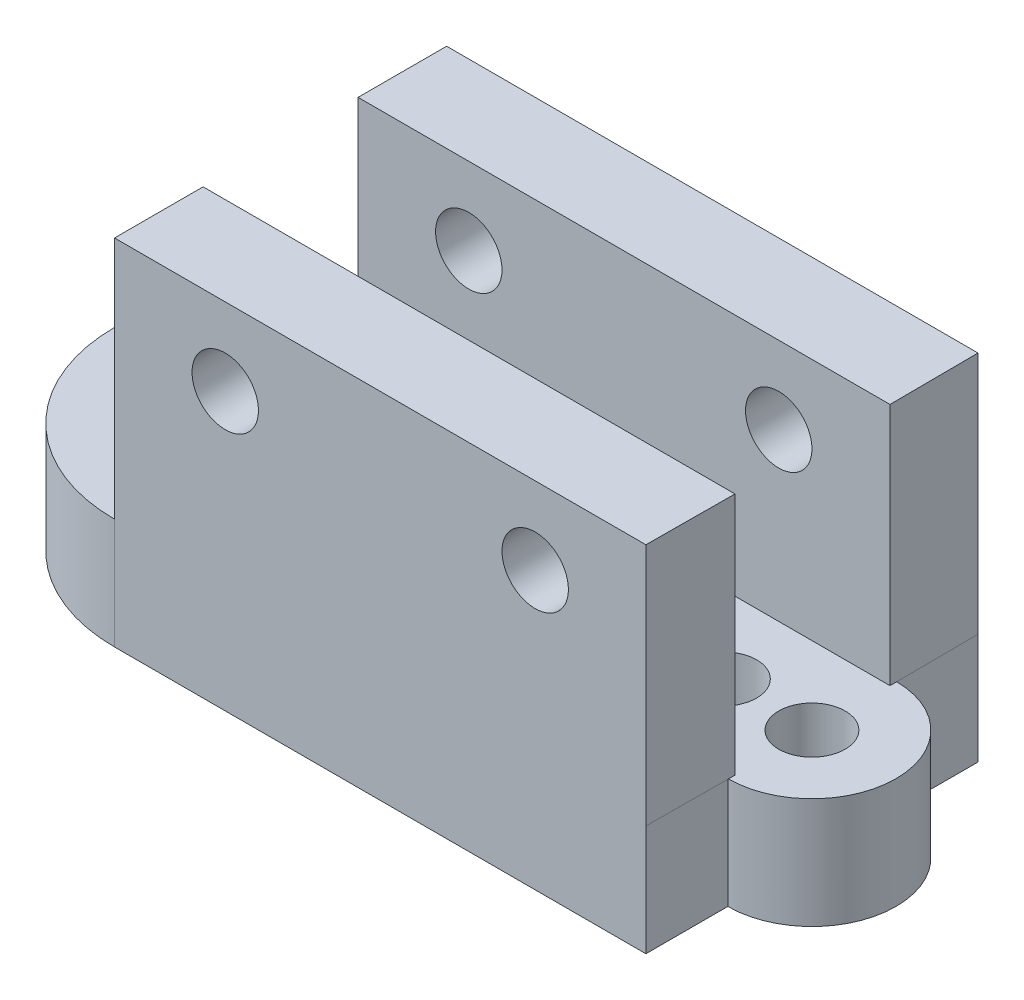
from build123d import *

# Parameters (mm, degrees)
SKETCH1_R                = 1.5
BOSS_EXTRUDE1_DEPTH      = 5
BOSS_EXTRUDE2_DEPTH      = 11
SKETCH3_W                = 2
SKETCH3_H                = 3.5
BOSS_EXTRUDE3_DEPTH      = 4
F_3_0_3_DIAMETER_HOLE2_D = 3


with BuildPart() as part:
    # Sketch1 → Boss-Extrude1 (new body)
    with BuildSketch(Plane(origin=(0, 0, 0), x_dir=(1, 0, 0), z_dir=(0, 1, 0))):
        with BuildLine():
            Line((24, -7.5), (24, -3.8))
            ThreePointArc((24, -3.8), (27.8, 0), (24, 3.8))
            Line((24, 3.8), (24, 7.5))
            Line((24, 7.5), (0, 7.5))
            ThreePointArc((0, 7.5), (-7.5, 0), (0, -7.5))
            Line((0, -7.5), (24, -7.5))
        make_face()
        with Locations(Location((20, 0, 0), (0, 0, 270))):
            Circle(SKETCH1_R, mode=Mode.SUBTRACT)
        with Locations(Location((24, 0, 0), (0, 0, 270))):
            Circle(SKETCH1_R, mode=Mode.SUBTRACT)
        with Locations(Location((0, 0, 0), (0, 0, 270))):
            Circle(SKETCH1_R, mode=Mode.SUBTRACT)
    extrude(amount=BOSS_EXTRUDE1_DEPTH)

    # Sketch2 → Boss-Extrude2 (add)
    with BuildSketch(Plane(origin=(0, 5, 0), x_dir=(1, 0, 0), z_dir=(0, 1, 0))):
        Polygon((0, -7.5), (0, -3.5), (24.024712411, -3.5), (24, -7.5), align=None)
        Polygon((24.024712411, 3.5), (24, 7.5), (0, 7.5), (0, 3.5), align=None)
    extrude(amount=BOSS_EXTRUDE2_DEPTH)

    # Sketch3 → Boss-Extrude3 (add)
    with BuildSketch(Plane(origin=(0, 5, 0), x_dir=(1, 0, 0), z_dir=(0, 1, 0))):
        Polygon((10, 0), (8, 0), (8, -3.5), (12, -3.5), (12, 0), align=None)
        with Locations((11, 1.75)):
            Rectangle(SKETCH3_W, SKETCH3_H)
        with Locations((9, 1.75)):
            Rectangle(SKETCH3_W, SKETCH3_H)
    extrude(amount=BOSS_EXTRUDE3_DEPTH)

    # Ø3.0 (3) Diameter Hole2 (through all)
    with Locations(Plane.XY.offset(7.5)):
        with Locations((19, 12.5), (5, 12.5)):
            Hole(F_3_0_3_DIAMETER_HOLE2_D / 2)


solid = part.part
